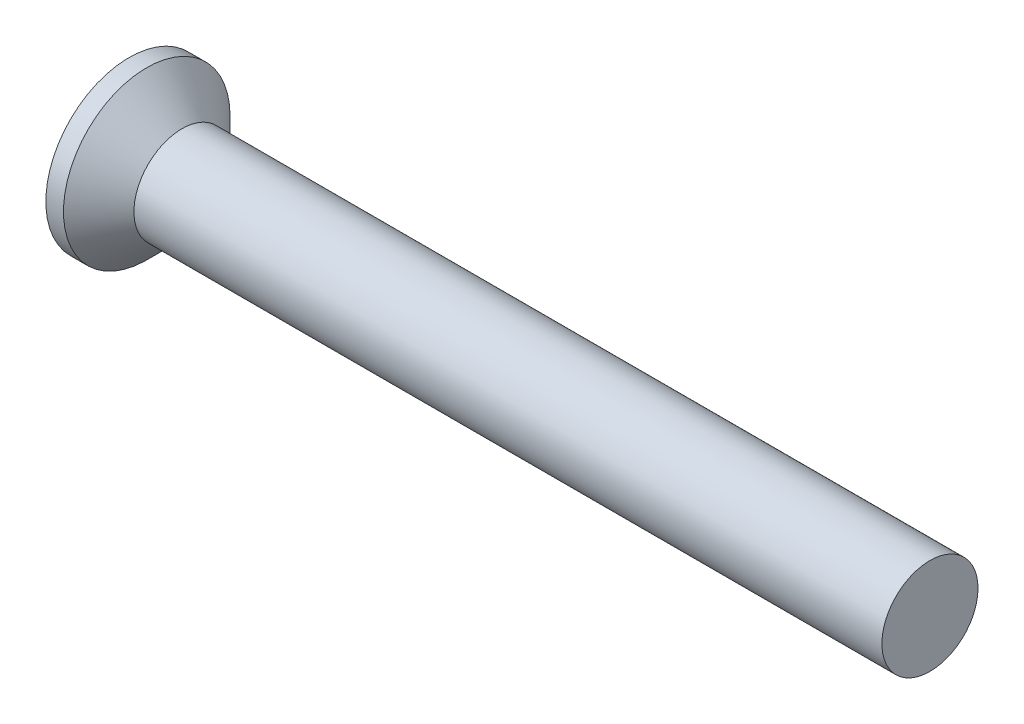
from build123d import *

# Parameters (mm, degrees)
CROSSRECESS_DEPTH = 0.825
DRAFT9_ANGLE      = 30
FILLET5_R         = 0.3
SKETCH10_W        = 0.5
SKETCH10_H        = 1.5


with BuildPart() as part:
    # Sketch1 → Base (revolve)
    with BuildSketch(Plane.XY, mode=Mode.PRIVATE) as base_sk:
        Polygon((25, 1.5), (2.65, 1.5), (1.65, 1.5), (0.55, 2.6), (0, 2.6), (0, 0), (25, 0), align=None)
    revolve(base_sk.sketch.rotate(Axis((4.515812911, 0, 0), (-1, 0, 0)), 90), axis=Axis((4.515812911, 0, 0), (-1, 0, 0)))

    # Sketch6 → CrossRecess (cut)
    with BuildSketch(Plane(origin=(0, 0, 0), x_dir=(0, 0, -1), z_dir=(1, 0, 0))):
        Polygon((0.32, 0.32), (0.32, 1.6), (-0.32, 1.6), (-0.32, 0.32), (-1.6, 0.32), (-1.6, -0.32), (-0.32, -0.32), (-0.32, -1.6), (0.32, -1.6), (0.32, -0.32), (1.6, -0.32), (1.6, 0.32), align=None)
    extrude(amount=CROSSRECESS_DEPTH, mode=Mode.SUBTRACT)

    # Draft9
    draft9_faces = [part.faces().sort_by_distance(p)[0] for p in [
        (0.4125, -1.6, 0),
        (0.4125, 0, 1.6),
        (0.4125, 0, -1.6),
        (0.4125, 1.6, 0),
    ]]
    draft(draft9_faces, Plane(origin=(0, 2.6, 0), x_dir=(0, 0, -1), z_dir=(-1, 0, 0)), DRAFT9_ANGLE)

    # Fillet5
    fillet5_edges = [part.edges().sort_by_distance(p)[0] for p in [
        (0.4125, 0.32, 0.32),
        (0.4125, -0.32, 0.32),
        (0.4125, -0.32, -0.32),
        (0.4125, 0.32, -0.32),
    ]]
    fillet(fillet5_edges, radius=FILLET5_R)

    # Sketch10 → Revolve2 (revolve)
    with BuildSketch(Plane.XY):
        with Locations((1.9, 0.75)):
            Rectangle(SKETCH10_W, SKETCH10_H)
    revolve(axis=Axis((62.228915663, 0, 0), (-1, 0, 0)))


solid = part.part
